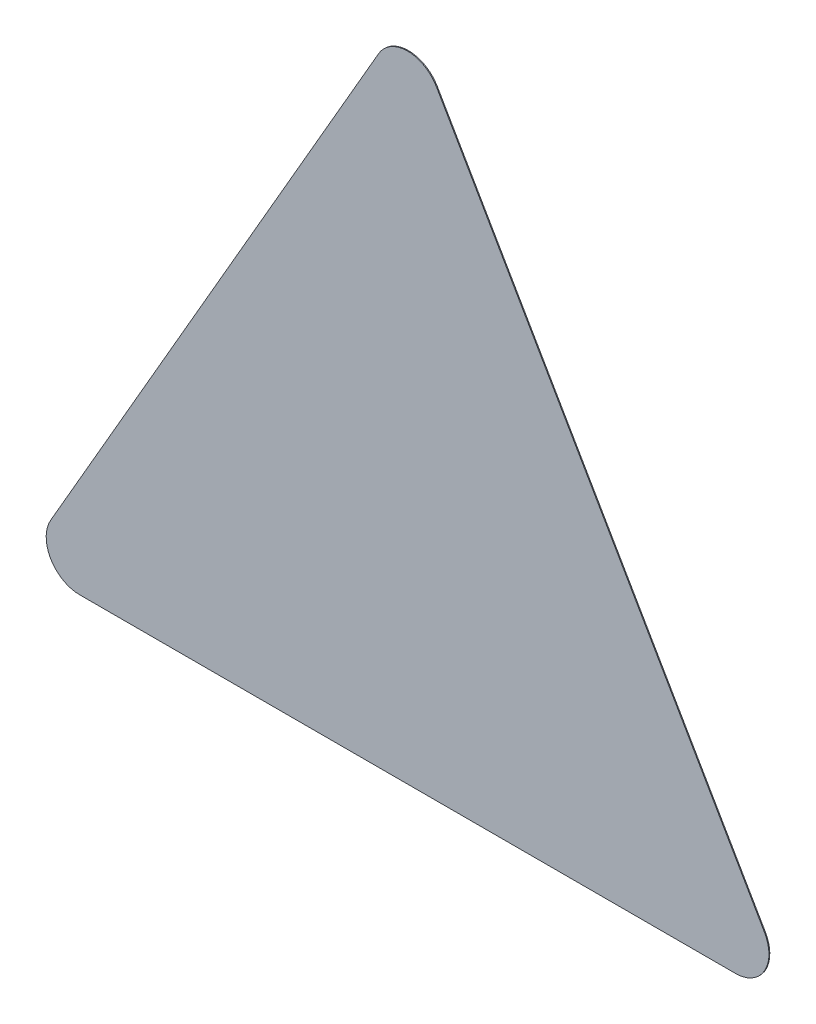
from build123d import *

# Parameters (mm, degrees)
BOSS_EXTRUDE1_DEPTH = 0.065


with BuildPart() as part:
    # Sketch1 → Boss-Extrude1 (new body)
    with BuildSketch(Plane.XY):
        with BuildLine():
            Line((-24.537373991, -25), (-5, -25))
            Line((-5, -25), (5, -25))
            Line((5, -25), (24.537373991, -25))
            ThreePointArc((24.537373991, -25), (26.702437374, -23.750000219), (26.702437752, -21.250000437))
            Line((26.702437752, -21.250000437), (2.165063762, 21.249997814))
            ThreePointArc((2.165063762, 21.249997814), (0, 22.499998252), (-2.165063762, 21.249997814))
            Line((-2.165063762, 21.249997814), (-26.702437752, -21.250000437))
            ThreePointArc((-26.702437752, -21.250000437), (-26.702437374, -23.750000219), (-24.537373991, -25))
        make_face()
    extrude(amount=BOSS_EXTRUDE1_DEPTH)


solid = part.part
